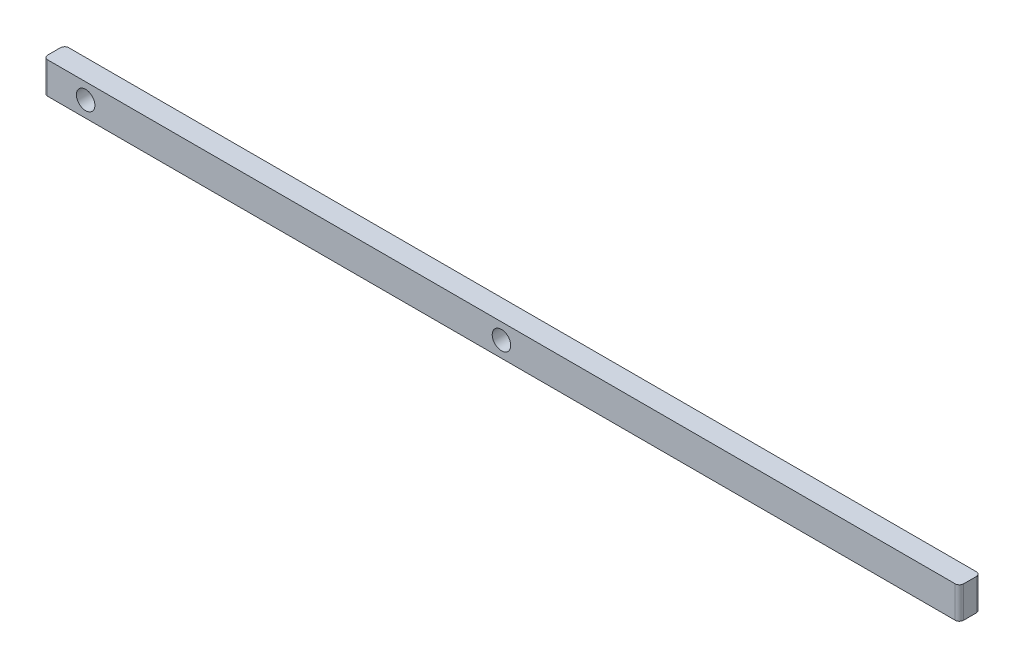
from build123d import *

# Parameters (mm, degrees)
SKETCH1_W               = 552.45
SKETCH1_H               = 19.05
BOSS_EXTRUDE1_DEPTH     = 6.35
CUT_EXTRUDE1_DEPTH      = 277.680802099
CUT_EXTRUDE1_DEPTH_BACK = 277.680802099
SKETCH2_R               = 5.588
FILLET1_R               = 2.54


with BuildPart() as part:
    # Sketch1 → Boss-Extrude1 (new, symmetric)
    with BuildSketch(Plane.XY):
        Rectangle(SKETCH1_W, SKETCH1_H)
    extrude(amount=BOSS_EXTRUDE1_DEPTH, both=True)

    # Sketch2 → Cut-Extrude1 (cut, two sides: drawn at the far end of the back side and taken through both)
    with BuildSketch(Plane.XY.offset(6.35).offset(-CUT_EXTRUDE1_DEPTH_BACK)):
        Circle(SKETCH2_R)
        with Locations((-250.825, 0)):
            Circle(SKETCH2_R)
    extrude(amount=CUT_EXTRUDE1_DEPTH + CUT_EXTRUDE1_DEPTH_BACK, mode=Mode.SUBTRACT)

    # Fillet1
    fillet1_edges = [part.edges().sort_by_distance(p)[0] for p in [
        (-276.225, 0, 6.35),
        (276.225, 0, 6.35),
        (-276.225, 0, -6.35),
        (276.225, 0, -6.35),
    ]]
    fillet(fillet1_edges, radius=FILLET1_R)


solid = part.part
